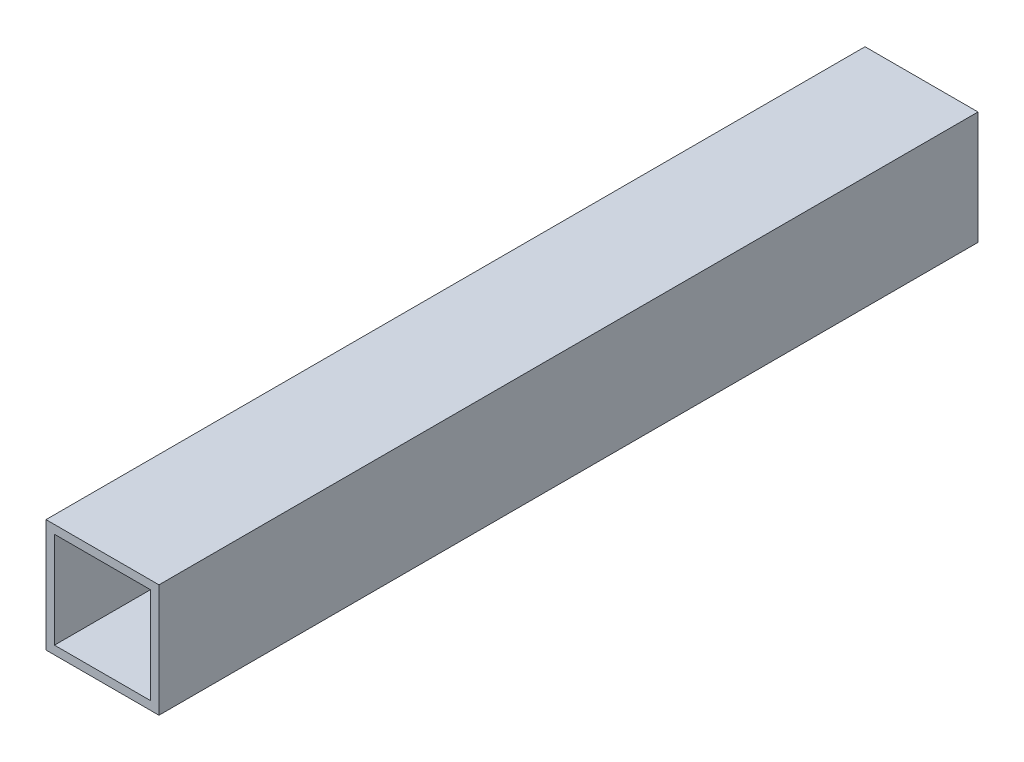
from build123d import *

# Parameters (mm, degrees)
CROQUIS1_W              = 20
CROQUIS1_H              = 20
CROQUIS1_W_2            = 17
CROQUIS1_H_2            = 17
SALIENTE_EXTRUIR1_DEPTH = 72.5


with BuildPart() as part:
    # Croquis1 → Saliente-Extruir1 (new, symmetric)
    with BuildSketch(Plane.XY):
        Rectangle(CROQUIS1_W, CROQUIS1_H)
        Rectangle(CROQUIS1_W_2, CROQUIS1_H_2, mode=Mode.SUBTRACT)
    extrude(amount=SALIENTE_EXTRUIR1_DEPTH, both=True)


solid = part.part
